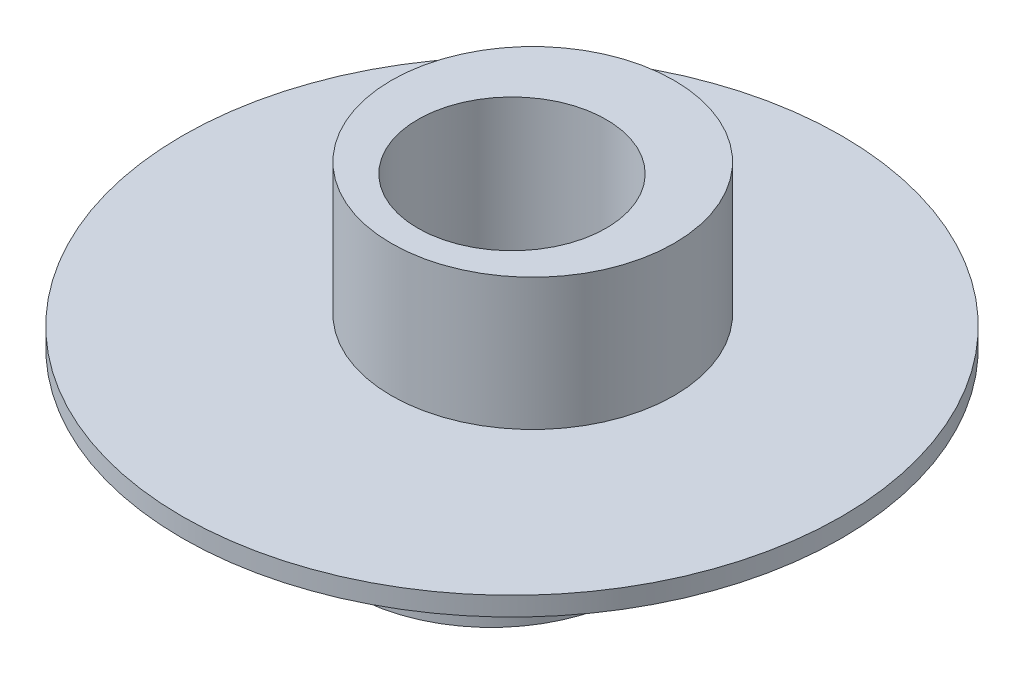
from build123d import *

# Parameters (mm, degrees)
SKETCH1_R           = 5
BOSS_EXTRUDE1_DEPTH = 13
SKETCH2_R           = 7.5
BOSS_EXTRUDE2_DEPTH = 8
SKETCH3_R           = 7.5
BOSS_EXTRUDE3_DEPTH = 7
SKETCH4_R           = 5
BOSS_EXTRUDE4_DEPTH = 13
SKETCH5_R           = 5
CUT_EXTRUDE1_DEPTH  = 43.558312936
SKETCH6_R           = 17.5
BOSS_EXTRUDE5_DEPTH = 1
SKETCH7_R           = 5
CUT_EXTRUDE2_DEPTH  = 27.009613607


with BuildPart() as part:
    # Sketch1 → Boss-Extrude1 (new body)
    with BuildSketch(Plane(origin=(0, 0, 0), x_dir=(1, 0, 0), z_dir=(0, 1, 0))):
        with Locations(Location((0, 0, 0), (0, 0, 90))):
            Circle(SKETCH1_R)
    extrude(amount=BOSS_EXTRUDE1_DEPTH)

    # Sketch2 → Boss-Extrude2 (add)
    with BuildSketch(Plane(origin=(0, 13, 0), x_dir=(1, 0, 0), z_dir=(0, 1, 0))):
        with Locations(Location((0, -1.1, 0), (0, 0, 270))):
            Circle(SKETCH2_R)
    extrude(amount=BOSS_EXTRUDE2_DEPTH)

    # Sketch3 → Boss-Extrude3 (add)
    with BuildSketch(Plane(origin=(0, 21, 0), x_dir=(1, 0, 0), z_dir=(0, 1, 0))):
        with Locations(Location((0, 1.1, 0), (0, 0, 188.433804098))):
            Circle(SKETCH3_R)
    extrude(amount=BOSS_EXTRUDE3_DEPTH)

    # Sketch4 → Boss-Extrude4 (add)
    with BuildSketch(Plane(origin=(0, 28, 0), x_dir=(1, 0, 0), z_dir=(0, 1, 0))):
        with Locations(Location((0, 0, 0), (0, 0, 90))):
            Circle(SKETCH4_R)
    extrude(amount=BOSS_EXTRUDE4_DEPTH)

    # Sketch5 → Cut-Extrude1 (cut, through all)
    with BuildSketch(Plane.XZ):
        with Locations(Location((0, 0, 0), (0, 0, 90))):
            Circle(SKETCH5_R)
    extrude(amount=-CUT_EXTRUDE1_DEPTH, mode=Mode.SUBTRACT)

    # Sketch6 → Boss-Extrude5 (add)
    with BuildSketch(Plane.XZ.offset(-21)):
        with Locations(Location((0, 0, 0), (0, 0, 270))):
            Circle(SKETCH6_R)
    extrude(amount=BOSS_EXTRUDE5_DEPTH)

    # Sketch7 → Cut-Extrude2 (cut, through all)
    with BuildSketch(Plane(origin=(0, 21, 0), x_dir=(1, 0, 0), z_dir=(0, 1, 0))):
        with Locations(Location((0, 0, 0), (0, 0, 270))):
            Circle(SKETCH7_R)
    extrude(amount=-CUT_EXTRUDE2_DEPTH, mode=Mode.SUBTRACT)


solid = part.part
